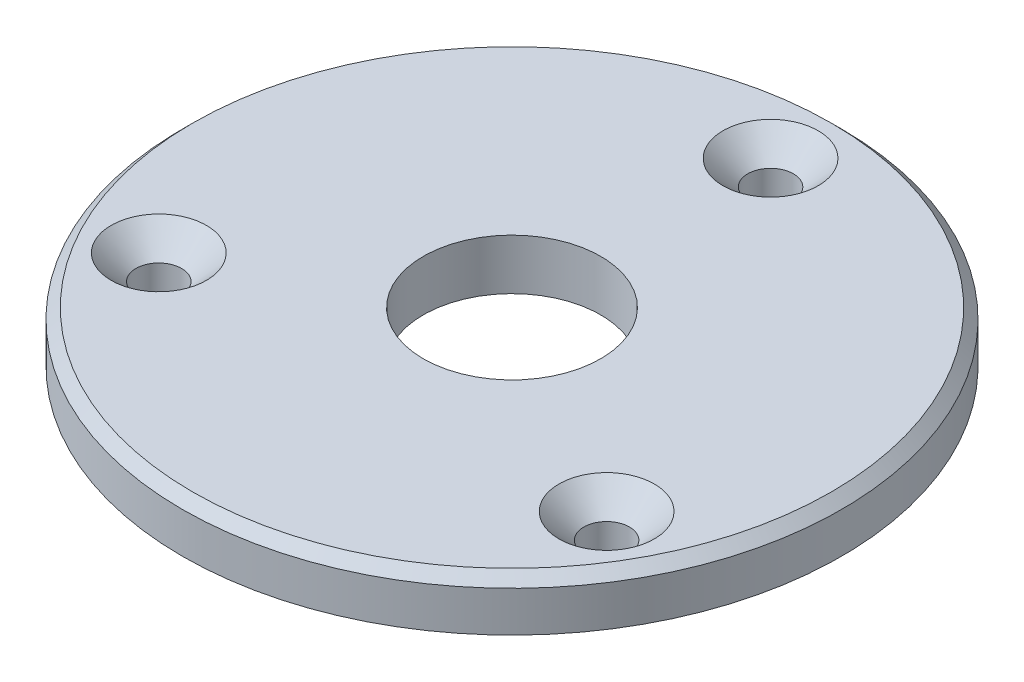
from build123d import *

# Parameters (mm, degrees)
SKETCH1_R                                     = 32.5
BOSS_EXTRUDE1_DEPTH                           = 5
CHAMFER1_SIZE                                 = 1
CSK_FOR_M4_COUNTERSUNK_FLAT_HEAD1_D           = 4.5
CSK_FOR_M4_COUNTERSUNK_FLAT_HEAD1_CSINK_D     = 9.4
CSK_FOR_M4_COUNTERSUNK_FLAT_HEAD1_CSINK_ANGLE = 90
M20X2_5_TAPPED_HOLE1_D                        = 17.5
M20X2_5_TAPPED_HOLE1_ON_FACE_2_D              = 17.5
CIRPATTERN1_COUNT                             = 3


with BuildPart() as part:
    # Sketch1 → Boss-Extrude1 (new body)
    with BuildSketch(Plane(origin=(0, 0, 0), x_dir=(1, 0, 0), z_dir=(0, 1, 0))):
        with Locations(Location((0, 0, 0), (0, 0, 270))):
            Circle(SKETCH1_R)
    extrude(amount=BOSS_EXTRUDE1_DEPTH)

    # Chamfer1
    chamfer1_edges = [part.edges().sort_by_distance(p)[0] for p in [
        (0, 5, -32.5),
    ]]
    chamfer(chamfer1_edges, length=CHAMFER1_SIZE)

    # CSK for M4 Countersunk Flat Head1 (through all)
    with Locations(Plane(origin=(0, 5, -25.5), x_dir=(0, 0, 1), z_dir=(0, 1, 0))):
        with Locations((0, 0)):
            csk_for_m4_countersunk_flat_head1 = CounterSinkHole(CSK_FOR_M4_COUNTERSUNK_FLAT_HEAD1_D / 2, CSK_FOR_M4_COUNTERSUNK_FLAT_HEAD1_CSINK_D / 2, counter_sink_angle=CSK_FOR_M4_COUNTERSUNK_FLAT_HEAD1_CSINK_ANGLE)

    # M20x2.5 Tapped Hole1 (through all)
    with Locations(Plane(origin=(0, 0, 0), x_dir=(0, 0, -1), z_dir=(0, -1, 0))):
        with Locations((0, 0)):
            Hole(M20X2_5_TAPPED_HOLE1_D / 2)

    # M20x2.5 Tapped Hole1 on face 2 (through all)
    with Locations(Plane.ZX.offset(5)):
        with Locations((0, 0)):
            Hole(M20X2_5_TAPPED_HOLE1_ON_FACE_2_D / 2)

    # CirPattern1: CSK for M4 Countersunk Flat Head1 ×3 about axis
    cirpattern1_axis = Axis((0, 0, 0), (0, 1, 0))
    for i in range(1, CIRPATTERN1_COUNT):
        add(csk_for_m4_countersunk_flat_head1.rotate(cirpattern1_axis, i * 360 / CIRPATTERN1_COUNT), mode=Mode.SUBTRACT)


solid = part.part
